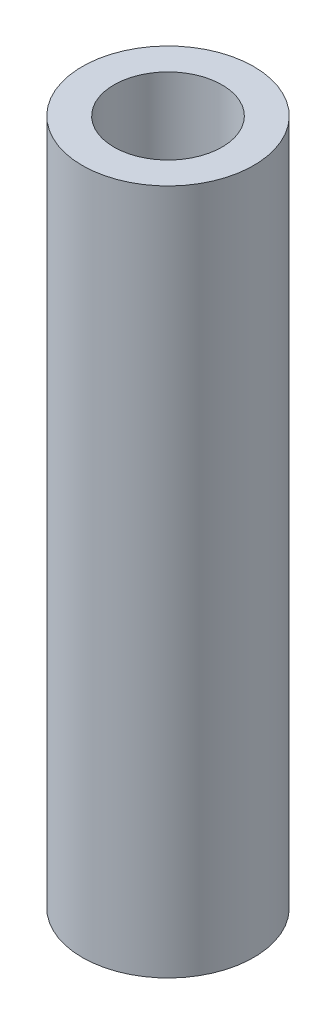
from build123d import *

# Parameters (mm, degrees)
SKETCH1_R           = 3.175
SKETCH1_R_2         = 2
BOSS_EXTRUDE1_DEPTH = 25.4


with BuildPart() as part:
    # Sketch1 → Boss-Extrude1 (new body)
    with BuildSketch(Plane(origin=(0, 0, 0), x_dir=(1, 0, 0), z_dir=(0, 1, 0))):
        with Locations(Location((0, 0, 0), (0, 0, 270))):
            Circle(SKETCH1_R)
        with Locations(Location((0, 0, 0), (0, 0, 270))):
            Circle(SKETCH1_R_2, mode=Mode.SUBTRACT)
    extrude(amount=-BOSS_EXTRUDE1_DEPTH)


solid = part.part
